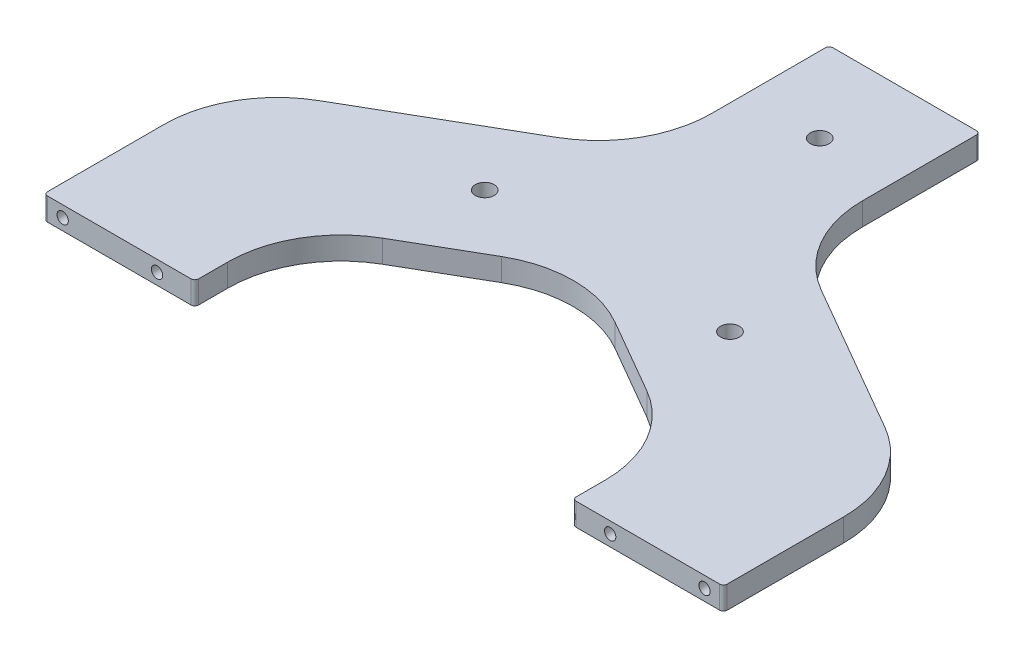
from build123d import *

# Parameters (mm, degrees)
EXTRUDE_1_DEPTH     = 6
SKETCH_3_R          = 2.5
CUT_EXTRUDE_1_DEPTH = 13
FILLET_1_R          = 30
FILLET_2_R          = 1
SKETCH_6_R          = 1.5
CUT_EXTRUDE_3_DEPTH = 15
SKETCH_7_R          = 1.5
CUT_EXTRUDE_4_DEPTH = 15


with BuildPart() as part:
    # 草图1 → 凸台-拉伸1 (new body)
    with BuildSketch(Plane(origin=(0, 0, 0), x_dir=(1, 0, 0), z_dir=(0, 1, 0))):
        Polygon((-20, 60), (20, 60), (20, 11.547005384), (70, -17.320508076), (90, -28.867513459), (90, -78), (50, -78), (50, -51.961524227), (0, -23.094010768), (-50, -51.961524227), (-50, -78), (-90, -78), (-90, -28.867513459), (-70, -17.320508076), (-20, 11.547005384), align=None)
    extrude(amount=EXTRUDE_1_DEPTH)

    # 草图3 → 切除-拉伸1 (cut)
    with BuildSketch(Plane(origin=(0, 6, 0), x_dir=(1, 0, 0), z_dir=(0, 1, 0))):
        with Locations(Location((0, 37.498899984, 0), (0, 0, 270))):
            Circle(SKETCH_3_R)
        with Locations(Location((32.475, -18.749449992, 0), (0, 0, 270))):
            Circle(SKETCH_3_R)
        with Locations(Location((-32.475, -18.749449992, 0), (0, 0, 270))):
            Circle(SKETCH_3_R)
    extrude(amount=-CUT_EXTRUDE_1_DEPTH, mode=Mode.SUBTRACT)

    # 圆角1
    fillet_1_edges = [part.edges().sort_by_distance(p)[0] for p in [
        (-20, 3, -11.547005384),
        (20, 3, -11.547005384),
        (90, 3, 28.867513459),
        (50, 3, 51.961524227),
        (0, 3, 23.094010768),
        (-50, 3, 51.961524227),
        (-90, 3, 28.867513459),
    ]]
    fillet(fillet_1_edges, radius=FILLET_1_R)

    # 圆角2
    fillet_2_edges = [part.edges().sort_by_distance(p)[0] for p in [
        (-20, 3, -60),
        (20, 3, -60),
        (90, 3, 78),
        (50, 3, 78),
        (-50, 3, 78),
        (-90, 3, 78),
    ]]
    fillet(fillet_2_edges, radius=FILLET_2_R)

    # 草图6 → 切除-拉伸3 (cut)
    with BuildSketch(Plane.XY.offset(78)):
        with Locations((60, 3)):
            Circle(SKETCH_6_R)
        with Locations((85, 3)):
            Circle(SKETCH_6_R)
        with Locations(Location((-85, 3, 0), (0, 0, 180))):
            Circle(SKETCH_6_R)
        with Locations(Location((-60, 3, 0), (0, 0, 180))):
            Circle(SKETCH_6_R)
    extrude(amount=-CUT_EXTRUDE_3_DEPTH, mode=Mode.SUBTRACT)

    # 草图7 → 切除-拉伸4 (cut)
    with BuildSketch(Plane(origin=(0, 0, -60), x_dir=(-1, 0, 0), z_dir=(0, 0, -1))):
        with Locations((12.5, 3)):
            Circle(SKETCH_7_R)
        with Locations((-12.5, 3)):
            Circle(SKETCH_7_R)
    extrude(amount=-CUT_EXTRUDE_4_DEPTH, mode=Mode.SUBTRACT)


solid = part.part
